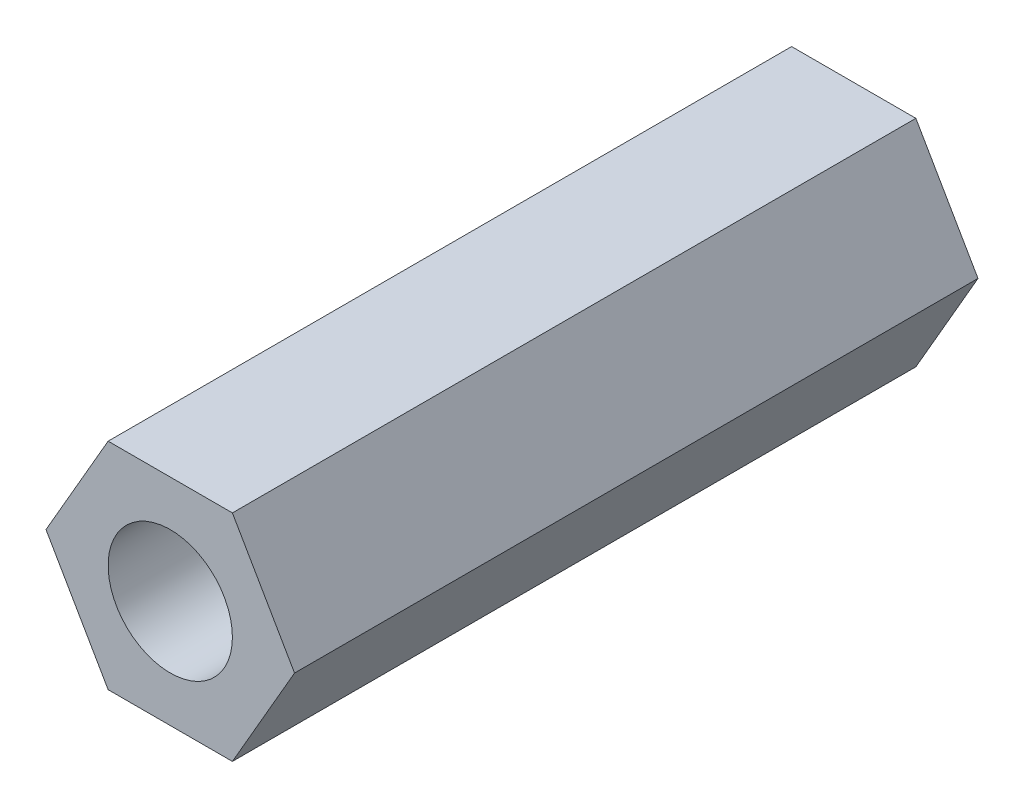
from build123d import *

# Parameters (mm, degrees)
SKETCH_1_R      = 2
EXTRUDE_1_DEPTH = 22


with BuildPart() as part:
    # 草图1 → 凸台-拉伸1 (new body)
    with BuildSketch(Plane.XY):
        Polygon((33.8, 29.8), (31.8, 33.264101615), (27.8, 33.264101615), (25.8, 29.8), (27.8, 26.335898385), (31.8, 26.335898385), align=None)
        with Locations((29.8, 29.8)):
            Circle(SKETCH_1_R, mode=Mode.SUBTRACT)
    extrude(amount=EXTRUDE_1_DEPTH)


solid = part.part
